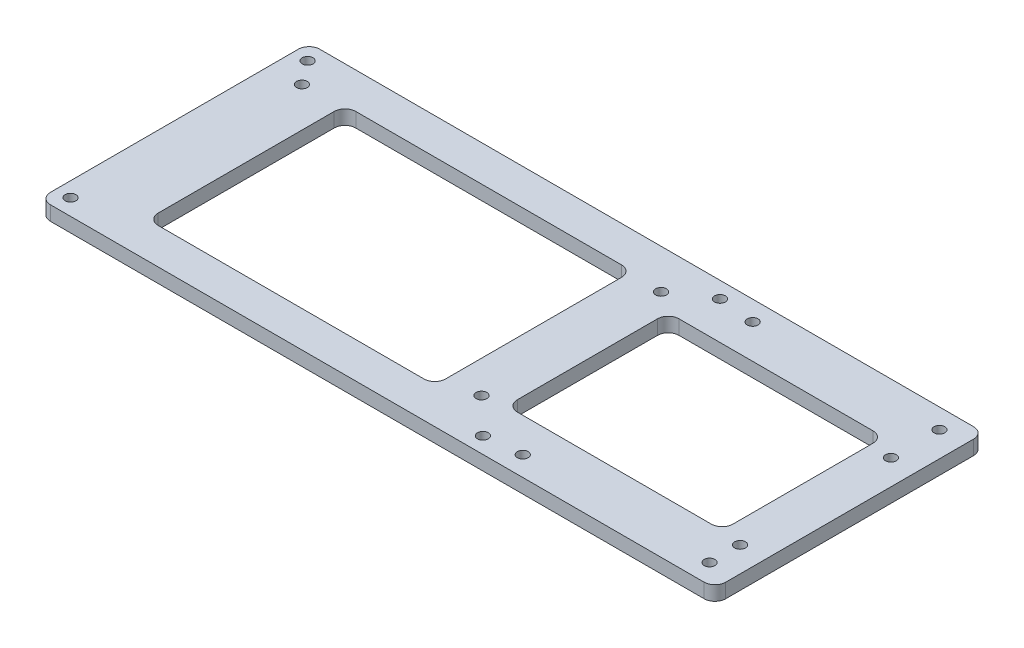
from build123d import *

# Parameters (mm, degrees)
SKETCH_1_W      = 188
SKETCH_1_H      = 75
SKETCH_1_W_2    = 60
SKETCH_1_H_2    = 45
SKETCH_1_R      = 1.5
SKETCH_1_W_3    = 80
SKETCH_1_H_3    = 55
EXTRUDE_1_DEPTH = 4
FILLET_1_R      = 3


with BuildPart() as part:
    # 草图1 → 凸台-拉伸1 (new body)
    with BuildSketch(Plane(origin=(0, 0, 0), x_dir=(1, 0, 0), z_dir=(0, 1, 0))):
        with Locations((31.5, 0)):
            Rectangle(SKETCH_1_W, SKETCH_1_H)
        with Locations((82.5, 0)):
            Rectangle(SKETCH_1_W_2, SKETCH_1_H_2, mode=Mode.SUBTRACT)
        with Locations(Location((-58.4, -33, 0), (0, 0, 270))):
            Circle(SKETCH_1_R, mode=Mode.SUBTRACT)
        with Locations(Location((56.4, -33, 0), (0, 0, 270))):
            Circle(SKETCH_1_R, mode=Mode.SUBTRACT)
        with Locations(Location((46.5, -23.5, 0), (0, 0, 270))):
            Circle(SKETCH_1_R, mode=Mode.SUBTRACT)
        with Locations((-2.5, 0)):
            Rectangle(SKETCH_1_W_3, SKETCH_1_H_3, mode=Mode.SUBTRACT)
        with Locations(Location((-53.5, 26.5, 0), (0, 0, 270))):
            Circle(SKETCH_1_R, mode=Mode.SUBTRACT)
        with Locations(Location((-58.4, 33, 0), (0, 0, 270))):
            Circle(SKETCH_1_R, mode=Mode.SUBTRACT)
        with Locations(Location((46.5, 26.5, 0), (0, 0, 270))):
            Circle(SKETCH_1_R, mode=Mode.SUBTRACT)
        with Locations(Location((56.4, 33, 0), (0, 0, 270))):
            Circle(SKETCH_1_R, mode=Mode.SUBTRACT)
        with Locations(Location((66.5, 32, 0), (0, 0, 270))):
            Circle(SKETCH_1_R, mode=Mode.SUBTRACT)
        with Locations(Location((118.5, 32, 0), (0, 0, 270))):
            Circle(SKETCH_1_R, mode=Mode.SUBTRACT)
        with Locations(Location((66.5, -32, 0), (0, 0, 270))):
            Circle(SKETCH_1_R, mode=Mode.SUBTRACT)
        with Locations(Location((118.5, -32, 0), (0, 0, 270))):
            Circle(SKETCH_1_R, mode=Mode.SUBTRACT)
        with Locations(Location((118.5, -23.5, 0), (0, 0, 270))):
            Circle(SKETCH_1_R, mode=Mode.SUBTRACT)
        with Locations(Location((118.5, 18.5, 0), (0, 0, 270))):
            Circle(SKETCH_1_R, mode=Mode.SUBTRACT)
    extrude(amount=EXTRUDE_1_DEPTH)

    # 圆角1
    fillet_1_edges = [part.edges().sort_by_distance(p)[0] for p in [
        (52.5, 2, 22.5),
        (112.5, 2, 22.5),
        (112.5, 2, -22.5),
        (52.5, 2, -22.5),
        (-42.5, 2, 27.5),
        (37.5, 2, 27.5),
        (37.5, 2, -27.5),
        (-42.5, 2, -27.5),
        (125.5, 2, 37.5),
        (-62.5, 2, 37.5),
        (-62.5, 2, -37.5),
        (125.5, 2, -37.5),
    ]]
    fillet(fillet_1_edges, radius=FILLET_1_R)


solid = part.part
